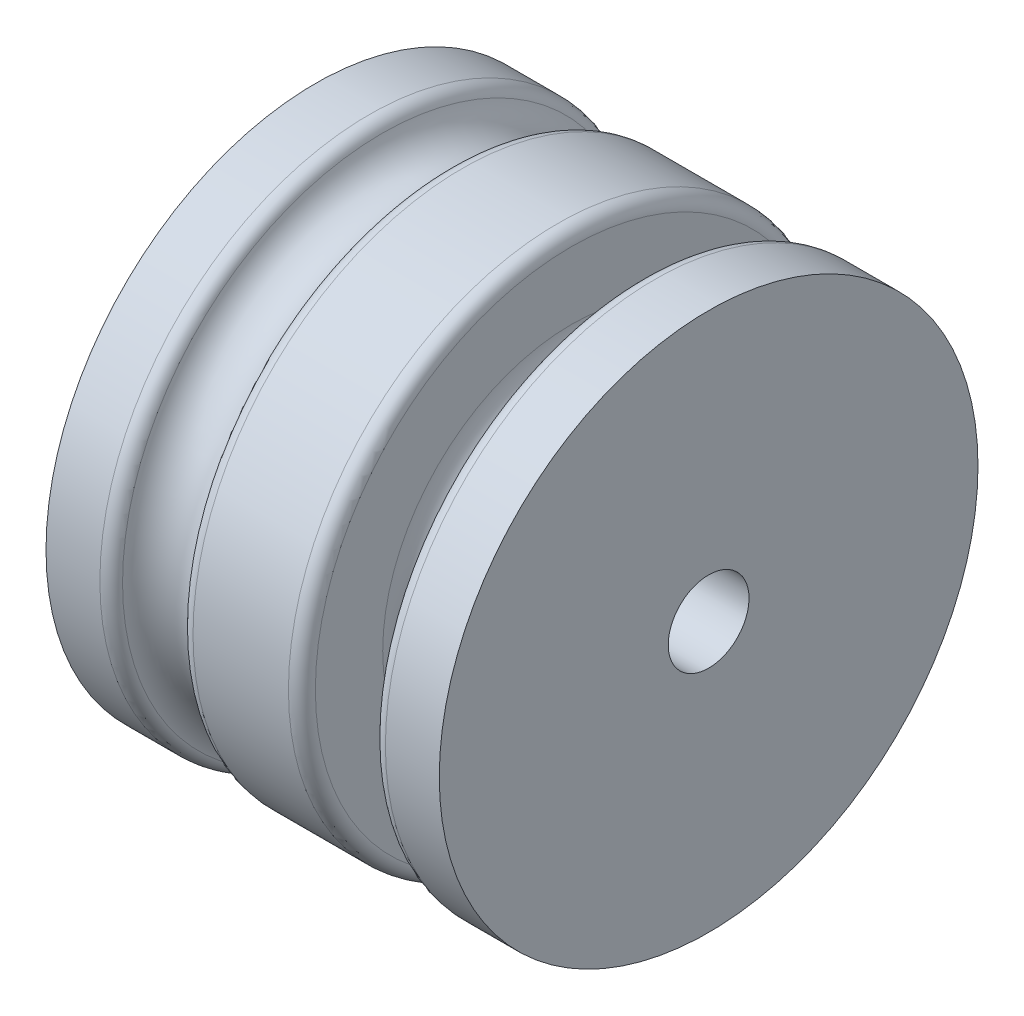
from build123d import *

# Parameters (mm, degrees)
SKETCH4_R          = 1.5
CUT_EXTRUDE1_DEPTH = 20


with BuildPart() as part:
    # Sketch1 → Revolve2 (revolve)
    with BuildSketch(Plane.XY, mode=Mode.PRIVATE) as revolve2_sk:
        with BuildLine():
            Line((-7.6, 10), (-7.6, 0))
            Line((-7.6, 0), (0, 0))
            Line((0, 0), (0, 10))
            Line((0, 10), (-2, 10))
            ThreePointArc((-2, 10), (-2.353553391, 9.853553391), (-2.5, 9.5))
            Line((-2.5, 9.5), (-2.5, 7))
            ThreePointArc((-2.5, 7), (-3.8, 5.7), (-5.1, 7))
            Line((-5.1, 7), (-5.1, 9.5))
            ThreePointArc((-5.1, 9.5), (-5.246446609, 9.853553391), (-5.6, 10))
            Line((-5.6, 10), (-7.6, 10))
        make_face()
        with BuildLine():
            Line((-14.6, 10), (-14.6, 0))
            Line((-14.6, 0), (-7.6, 0))
            Line((-7.6, 0), (-7.6, 10))
            Line((-7.6, 10), (-9.141676707, 10))
            ThreePointArc((-9.141676707, 10), (-9.442139313, 9.899652627), (-9.621999386, 9.638888889))
            ThreePointArc((-9.621999386, 9.638888889), (-10.870838353, 8.7), (-12.11967732, 9.638888889))
            ThreePointArc((-12.11967732, 9.638888889), (-12.299537394, 9.899652627), (-12.6, 10))
            Line((-12.6, 10), (-14.6, 10))
        make_face()
    revolve(revolve2_sk.sketch.rotate(Axis((-7.6, 0, 0), (1, 0, 0)), 90), axis=Axis((-7.6, 0, 0), (1, 0, 0)))

    # Sketch4 → Cut-Extrude1 (cut)
    with BuildSketch(Plane(origin=(0, 0, 0), x_dir=(0, 0, -1), z_dir=(1, 0, 0))):
        with Locations(Location((0, 0, 0), (0, 0, 90))):
            Circle(SKETCH4_R)
    extrude(amount=-CUT_EXTRUDE1_DEPTH, mode=Mode.SUBTRACT)


solid = part.part
